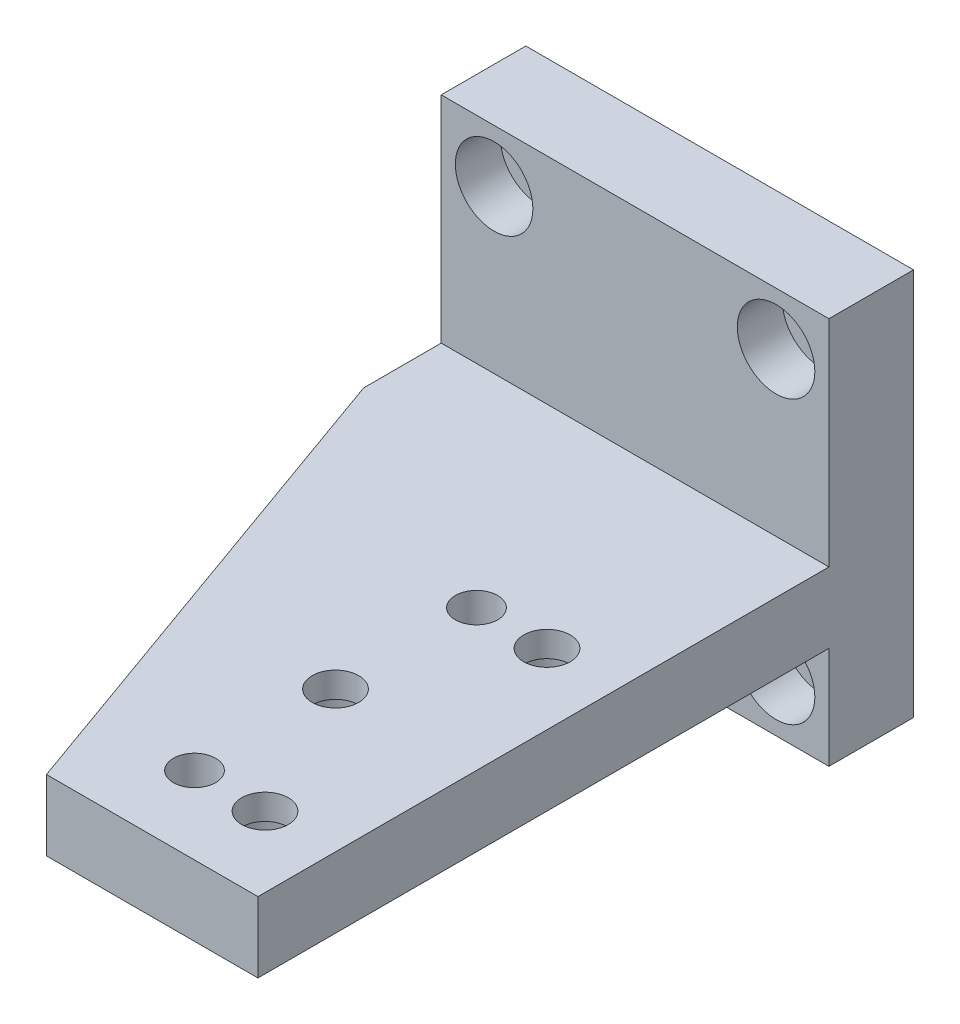
from build123d import *

# Parameters (mm, degrees)
SKETCH1_W                                           = 55
SKETCH1_H                                           = 55
BOSS_EXTRUDE1_DEPTH                                 = 6
CBORE_FOR_M6_HEX_SOCKET_HEAD_CAP_SCREW1_D           = 6.6
CBORE_FOR_M6_HEX_SOCKET_HEAD_CAP_SCREW1_CBORE_D     = 11
CBORE_FOR_M6_HEX_SOCKET_HEAD_CAP_SCREW1_CBORE_DEPTH = 6.4
SKETCH4_W                                           = 55
SKETCH4_H                                           = 10
BOSS_EXTRUDE2_DEPTH                                 = 81
CBORE_FOR_M6_HEX_SOCKET_HEAD_CAP_SCREW2_D           = 6.6
CBORE_FOR_M6_HEX_SOCKET_HEAD_CAP_SCREW2_CBORE_D     = 11
CBORE_FOR_M6_HEX_SOCKET_HEAD_CAP_SCREW2_CBORE_DEPTH = 6.4
CHAMFER1_SIZE                                       = 70
CHAMFER1_SIZE2                                      = 25
F_6_0MM_DOWEL_HOLE1_D                               = 6


with BuildPart() as part:
    # Sketch1 → Boss-Extrude1 (new, symmetric)
    with BuildSketch(Plane.XY):
        Rectangle(SKETCH1_W, SKETCH1_H)
    extrude(amount=BOSS_EXTRUDE1_DEPTH, both=True)

    # CBORE for M6 Hex Socket Head Cap Screw1 (through all)
    with Locations(Plane.XY.offset(6)):
        with Locations((-20, 20), (20, 20), (20, -20), (-20, -20)):
            CounterBoreHole(CBORE_FOR_M6_HEX_SOCKET_HEAD_CAP_SCREW1_D / 2, CBORE_FOR_M6_HEX_SOCKET_HEAD_CAP_SCREW1_CBORE_D / 2, CBORE_FOR_M6_HEX_SOCKET_HEAD_CAP_SCREW1_CBORE_DEPTH)

    # Sketch4 → Boss-Extrude2 (add)
    with BuildSketch(Plane.XY.offset(6)):
        with Locations((0, -8)):
            Rectangle(SKETCH4_W, SKETCH4_H)
    extrude(amount=BOSS_EXTRUDE2_DEPTH)

    # CBORE for M6 Hex Socket Head Cap Screw2 (through all)
    with Locations(Plane(origin=(0, -13, 0), x_dir=(-1, 0, 0), z_dir=(0, -1, 0))):
        with Locations((-17.5, -76), (-7.5, -56), (-17.5, -36)):
            CounterBoreHole(CBORE_FOR_M6_HEX_SOCKET_HEAD_CAP_SCREW2_D / 2, CBORE_FOR_M6_HEX_SOCKET_HEAD_CAP_SCREW2_CBORE_D / 2, CBORE_FOR_M6_HEX_SOCKET_HEAD_CAP_SCREW2_CBORE_DEPTH)

    # Chamfer1
    chamfer1_edges = [part.edges().sort_by_distance(p)[0] for p in [
        (-27.5, -8, 87),
    ]]
    chamfer1_side = [part.faces().sort_by_distance(p)[0] for p in [
        (-27.5, -4.408163265, 25.62244898),
    ]]
    chamfer(chamfer1_edges, length=CHAMFER1_SIZE, length2=CHAMFER1_SIZE2, reference=chamfer1_side[0])

    # Ø6.0mm Dowel Hole1 (through all)
    with Locations(Plane(origin=(0, -13, 0), x_dir=(-1, 0, 0), z_dir=(0, -1, 0))):
        with Locations((-7.5, -36), (-7.5, -76)):
            Hole(F_6_0MM_DOWEL_HOLE1_D / 2)


solid = part.part
